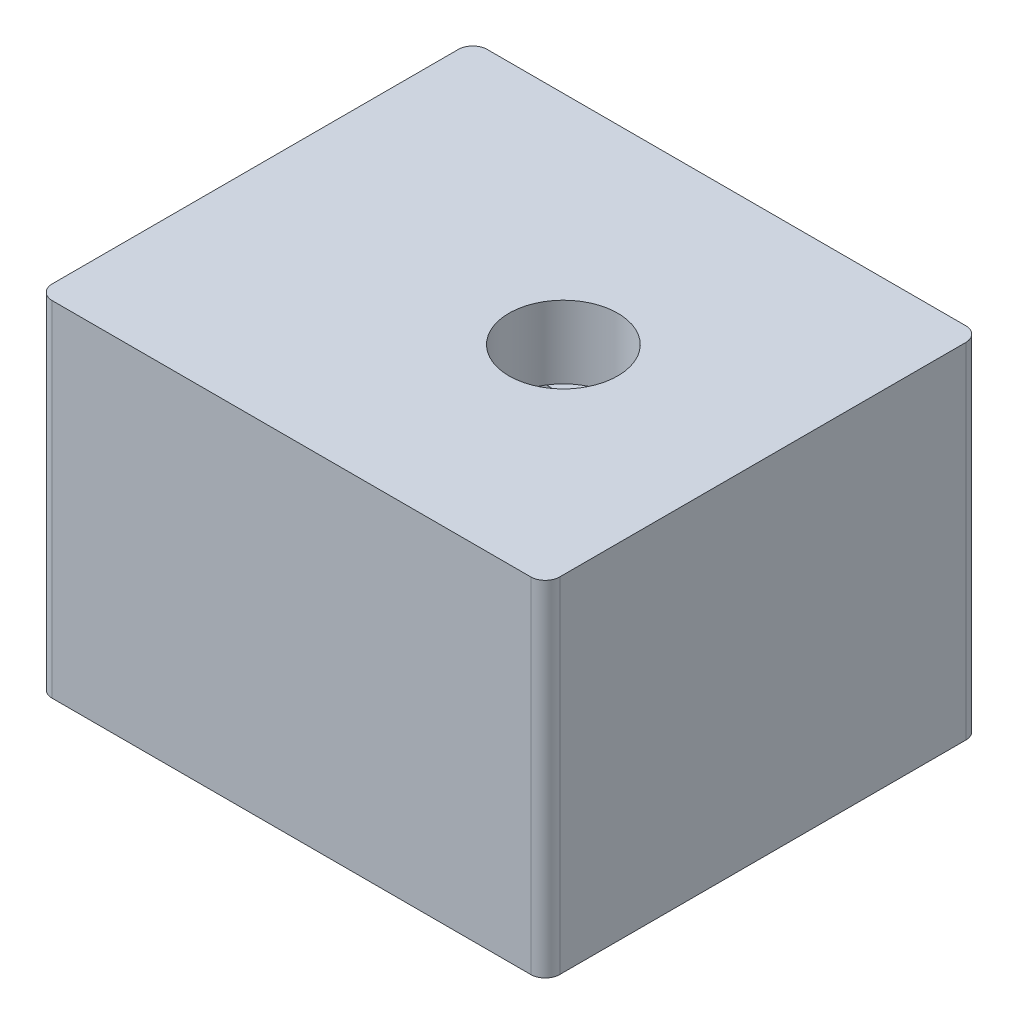
from build123d import *

# Parameters (mm, degrees)
BOX_EXTRUDE_DEPTH             = 90
BOX_EXTRUDE_DEPTH_BACK        = 5
SKETCH2_W                     = 140
SKETCH2_H                     = 120
BOX_INNER_CUT_START           = -20
SKETCH3_W                     = 120
SKETCH3_H                     = 100
BOX_INNER_CUT_DEPTH           = 50
SHAFT_CUT_START               = -70
SKETCH6_R                     = 6
SHAFT_CUT_DEPTH               = 20
BEARING_CUTS_INSIDE_BOX_START = -70
SKETCH9_R                     = 8
SKETCH9_R_2                   = 16
BEARING_CUTS_INSIDE_BOX_DEPTH = 10
SCISSOR_CUT_START             = -10
SKETCH11_W                    = 120
SKETCH11_H                    = 14
SCISSOR_CUT_DEPTH             = 156.529453572
LEFT_BEARING_LID_CUT_START    = -10
SKETCH18_R                    = 8
LEFT_BEARING_LID_CUT_DEPTH    = 10
RIGHT_BEARING_LID_CUT_REACH   = 134.382
SKETCH12_R                    = 15
OUTER_EDGES_FILLET_R          = 4


with BuildPart() as part:
    # Sketch2 → BOX_EXTRUDE (new, two sides: drawn at the far end of the back side and taken through both)
    with BuildSketch(Plane(origin=(0, 0, 0), x_dir=(1, 0, 0), z_dir=(0, 1, 0)).offset(-BOX_EXTRUDE_DEPTH_BACK)):
        Rectangle(SKETCH2_W, SKETCH2_H)
    extrude(amount=BOX_EXTRUDE_DEPTH + BOX_EXTRUDE_DEPTH_BACK)

    # Sketch3 → BOX_INNER_CUT (cut)
    with BuildSketch(Plane(origin=(0, 90, 0), x_dir=(1, 0, 0), z_dir=(0, 1, 0)).offset(BOX_INNER_CUT_START)):
        Rectangle(SKETCH3_W, SKETCH3_H)
    extrude(amount=-BOX_INNER_CUT_DEPTH, mode=Mode.SUBTRACT)

    # Sketch6 → SHAFT_CUT (cut)
    with BuildSketch(Plane(origin=(0, 90, 0), x_dir=(1, 0, 0), z_dir=(0, 1, 0)).offset(SHAFT_CUT_START)):
        with Locations(Location((15, 0, 0), (0, 0, 270))):
            Circle(SKETCH6_R)
        with Locations(Location((-15, 0, 0), (0, 0, 90))):
            Circle(SKETCH6_R)
    extrude(amount=-SHAFT_CUT_DEPTH, mode=Mode.SUBTRACT)

    # Sketch9 → BEARING_CUTS_INSIDE_BOX (cut)
    with BuildSketch(Plane(origin=(0, 90, 0), x_dir=(1, 0, 0), z_dir=(0, 1, 0)).offset(BEARING_CUTS_INSIDE_BOX_START)):
        with Locations(Location((15, 0, 0), (0, 0, 270))):
            Circle(SKETCH9_R)
        with Locations(Location((-15, 0, 0), (0, 0, 270))):
            Circle(SKETCH9_R_2)
    extrude(amount=-BEARING_CUTS_INSIDE_BOX_DEPTH, mode=Mode.SUBTRACT)

    # Sketch11 → SCISSOR_CUT (cut, through all)
    with BuildSketch(Plane.XY.offset(60).offset(SCISSOR_CUT_START)):
        with Locations((0, 35)):
            Rectangle(SKETCH11_W, SKETCH11_H)
    extrude(amount=-SCISSOR_CUT_DEPTH, mode=Mode.SUBTRACT)

    # Sketch18 → LEFT_BEARING_LID_CUT (cut)
    with BuildSketch(Plane(origin=(0, 90, 0), x_dir=(1, 0, 0), z_dir=(0, 1, 0)).offset(LEFT_BEARING_LID_CUT_START)):
        with Locations(Location((-15, 0, 0), (0, 0, 270))):
            Circle(SKETCH18_R)
    extrude(amount=-LEFT_BEARING_LID_CUT_DEPTH, mode=Mode.SUBTRACT)

    # Sketch12 → RIGHT_BEARING_LID_CUT (cut, up to next)
    with BuildSketch(Plane(origin=(0, 90, 0), x_dir=(1, 0, 0), z_dir=(0, 1, 0)), mode=Mode.PRIVATE) as right_bearing_lid_cut_sk1:
        with Locations(Location((15, 0, 0), (0, 0, 270))):
            Circle(SKETCH12_R)
    right_bearing_lid_cut_tool1 = extrude(right_bearing_lid_cut_sk1.sketch, amount=-RIGHT_BEARING_LID_CUT_REACH, mode=Mode.PRIVATE) & part.part
    add(right_bearing_lid_cut_tool1.solids().sort_by_distance((15, 90, 0))[0], mode=Mode.SUBTRACT)

    # OUTER_EDGES_FILLET
    outer_edges_fillet_edges = [part.edges().sort_by_distance(p)[0] for p in [
        (-70, 42.5, -60),
        (70, 42.5, -60),
        (70, 42.5, 60),
        (-70, 42.5, 60),
    ]]
    fillet(outer_edges_fillet_edges, radius=OUTER_EDGES_FILLET_R)


solid = part.part
